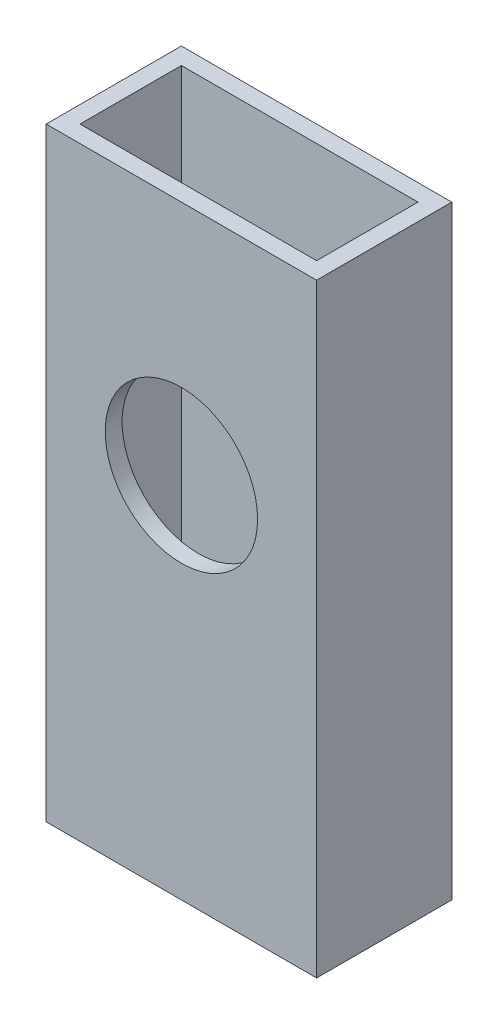
from build123d import *

# Parameters (mm, degrees)
SKETCH1_W           = 50.8
SKETCH1_H           = 113.538
BOSS_EXTRUDE1_DEPTH = 25.4
SHELL1_T            = -3.175
SKETCH2_R           = 14.3129
CUT_EXTRUDE1_DEPTH  = 25.4


with BuildPart() as part:
    # Sketch1 → Boss-Extrude1 (new body)
    with BuildSketch(Plane.XY):
        Rectangle(SKETCH1_W, SKETCH1_H)
    extrude(amount=BOSS_EXTRUDE1_DEPTH)

    # Shell1
    shell1_openings = [part.faces().sort_by_distance(p)[0] for p in [
        (0, -56.769, 12.7),
        (0, 56.769, 12.7),
    ]]
    offset(amount=SHELL1_T, openings=shell1_openings, kind=Kind.INTERSECTION)

    # Sketch2 → Cut-Extrude1 (cut)
    with BuildSketch(Plane.XY.offset(25.4)):
        with Locations((0, 12.319)):
            Circle(SKETCH2_R)
    extrude(amount=-CUT_EXTRUDE1_DEPTH, mode=Mode.SUBTRACT)


solid = part.part
